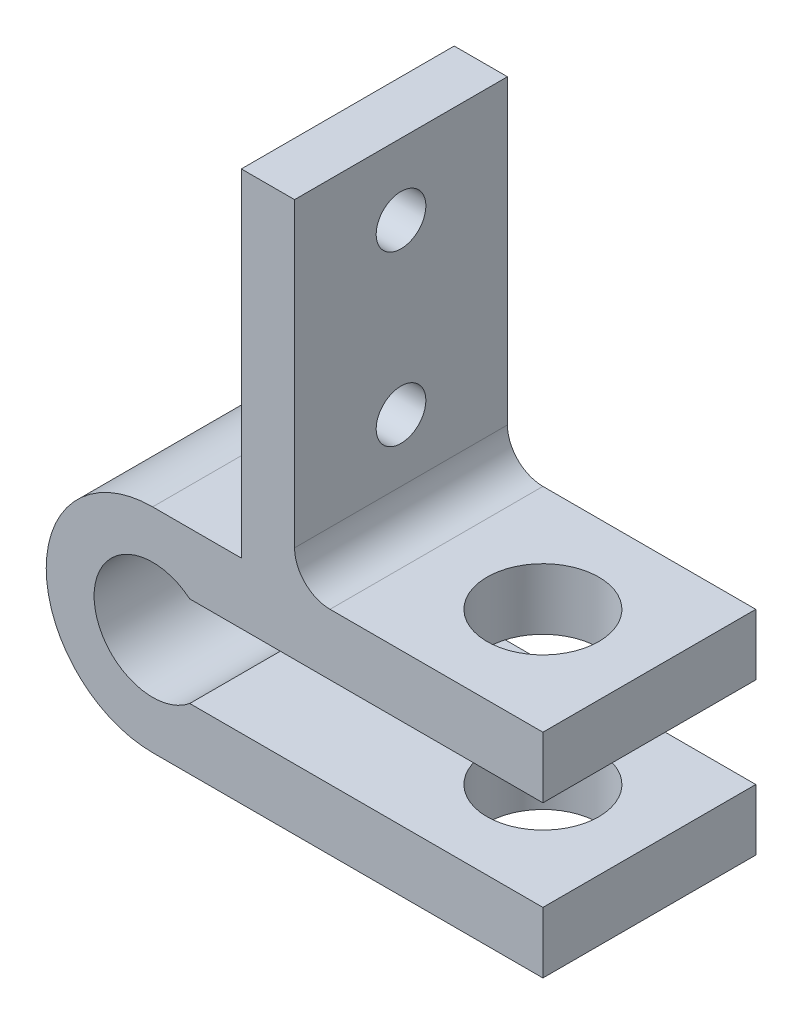
from build123d import *

# Parameters (mm, degrees)
BOSS_EXTRUDE1_DEPTH     = 12
CUT_EXTRUDE1_DEPTH      = 36.397740041
CUT_EXTRUDE1_DEPTH_BACK = 36.397740041
SKETCH2_R               = 3.15
CUT_EXTRUDE2_REACH      = 34.527
SKETCH3_R               = 1.4


with BuildPart() as part:
    # Sketch1 → Boss-Extrude1 (new body)
    with BuildSketch(Plane.XY):
        with BuildLine():
            Line((10, 6), (22, 6))
            Line((22, 6), (22, 2.552710574))
            Line((22, 2.552710574), (2.091331807, 2.552710574))
            ThreePointArc((2.091331807, 2.552710574), (-3.3, 0), (2.091331807, -2.552710574))
            Line((2.091331807, -2.552710574), (22, -2.552710574))
            Line((22, -2.552710574), (22, -6))
            Line((22, -6), (0, -6))
            ThreePointArc((0, -6), (-6, 0), (0, 6))
            Line((0, 6), (5, 6))
            Line((5, 6), (5, 25))
            Line((5, 25), (8, 25))
            Line((8, 25), (8, 8))
            ThreePointArc((8, 8), (8.585786438, 6.585786438), (10, 6))
        make_face()
    extrude(amount=BOSS_EXTRUDE1_DEPTH)

    # Sketch2 → Cut-Extrude1 (cut, two sides: drawn at the far end of the back side and taken through both)
    with BuildSketch(Plane(origin=(0, 0, 0), x_dir=(1, 0, 0), z_dir=(0, 1, 0)).offset(-CUT_EXTRUDE1_DEPTH_BACK)):
        with Locations(Location((16, -6, 0), (0, 0, 270))):
            Circle(SKETCH2_R)
    extrude(amount=CUT_EXTRUDE1_DEPTH + CUT_EXTRUDE1_DEPTH_BACK, mode=Mode.SUBTRACT)

    # Sketch3 → Cut-Extrude2 (cut, up to next)
    with BuildSketch(Plane.ZY.offset(-5), mode=Mode.PRIVATE) as cut_extrude2_sk1:
        with Locations((6, 21)):
            Circle(SKETCH3_R)
    cut_extrude2_tool1 = extrude(cut_extrude2_sk1.sketch, amount=-CUT_EXTRUDE2_REACH, mode=Mode.PRIVATE) & part.part
    # Sketch3 → Cut-Extrude2 (cut, up to next)
    with BuildSketch(Plane.ZY.offset(-5), mode=Mode.PRIVATE) as cut_extrude2_sk2:
        with Locations((6, 11.5)):
            Circle(SKETCH3_R)
    cut_extrude2_tool2 = extrude(cut_extrude2_sk2.sketch, amount=-CUT_EXTRUDE2_REACH, mode=Mode.PRIVATE) & part.part
    add(cut_extrude2_tool1.solids().sort_by_distance((5, 21, 6))[0], mode=Mode.SUBTRACT)
    add(cut_extrude2_tool2.solids().sort_by_distance((5, 11.5, 6))[0], mode=Mode.SUBTRACT)


solid = part.part
